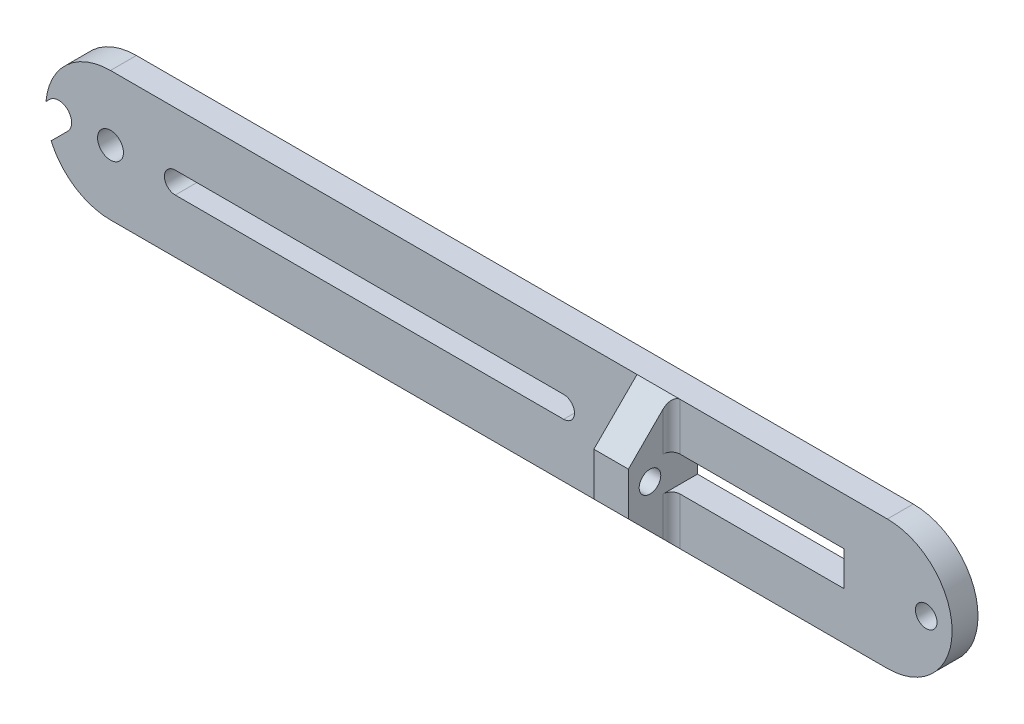
from build123d import *

# Parameters (mm, degrees)
ESQUISSE1_R             = 2.5
ESQUISSE1_R_2           = 3
ESQUISSE1_W             = 40
ESQUISSE1_H             = 8
BOSS_EXTRU_1_DEPTH      = 6
ESQUISSE2_R             = 2.5
BOSS_EXTRU_2_DEPTH      = 8
CONG_2_R                = 2
ENL_V_MAT_EXTRU_1_DEPTH = 4
ENL_V_START             = -10
ENL_V_MAT_EXTRU_4_DEPTH = 10


with BuildPart() as part:
    # Esquisse1 → Boss.-Extru.1 (new body)
    with BuildSketch(Plane.XY):
        with BuildLine():
            Line((90, -15), (-90, -15))
            ThreePointArc((-90, -15), (-105, 0), (-90, 15))
            Line((-90, 15), (90, 15))
            ThreePointArc((90, 15), (105, 0), (90, -15))
        make_face()
        with Locations((99, 0)):
            Circle(ESQUISSE1_R, mode=Mode.SUBTRACT)
        with Locations(Location((-90, 0, 0), (0, 0, 180))):
            Circle(ESQUISSE1_R_2, mode=Mode.SUBTRACT)
        with BuildLine():
            Line((15, -2.5), (-75, -2.5))
            ThreePointArc((-75, -2.5), (-77.5, 0), (-75, 2.5))
            Line((-75, 2.5), (15, 2.5))
            ThreePointArc((15, 2.5), (17.5, 0), (15, -2.5))
        make_face(mode=Mode.SUBTRACT)
        with Locations((60, 0)):
            Rectangle(ESQUISSE1_W, ESQUISSE1_H, mode=Mode.SUBTRACT)
    extrude(amount=BOSS_EXTRU_1_DEPTH)

    # Esquisse2 → Boss.-Extru.2 (add)
    with BuildSketch(Plane(origin=(40, 0, 0), x_dir=(0, 0, -1), z_dir=(1, 0, 0))):
        Polygon((-16, 5), (-16, -5), (-6, -15), (-6, -5), (-6, 5), (-6, 15), align=None)
        with Locations((-11, 0)):
            Circle(ESQUISSE2_R, mode=Mode.SUBTRACT)
    extrude(amount=-BOSS_EXTRU_2_DEPTH)

    # Congé2
    cong_2_edges = [part.edges().sort_by_distance(p)[0] for p in [
        (40, 9.5, 6),
        (40, -9.5, 6),
    ]]
    fillet(cong_2_edges, radius=CONG_2_R)

    # Esquisse3 → Enlèv. mat.-Extru.1 (cut)
    with BuildSketch(Plane.ZY.offset(-32)):
        Polygon((11, 4), (14.464101615, 2), (14.464101615, -2), (11, -4), (7.535898385, -2), (7.535898385, 2), align=None)
    extrude(amount=-ENL_V_MAT_EXTRU_1_DEPTH, mode=Mode.SUBTRACT)

    # Esquisse4 → Enlèv. mat.-Extru.4 (cut)
    with BuildSketch(Plane.XY.offset(6).offset(ENL_V_START)):
        with BuildLine():
            ThreePointArc((-105, -2.6e-08), (-103.148050285, -2.771638603), (-99.878679656, -2.121320344))
            Line((-99.878679656, -2.121320344), (-104.121320344, 2.121320344))
            ThreePointArc((-104.121320344, 2.121320344), (-104.771638603, 1.148050285), (-105, -2.6e-08))
        make_face()
        with BuildLine():
            Line((-104.121320344, 2.121320344), (-99.878679656, -2.121320344))
            ThreePointArc((-99.878679656, -2.121320344), (-99.228361402, -1.148050297), (-99, 0))
            ThreePointArc((-99, 0), (-100.851949703, 2.771638598), (-104.121320344, 2.121320344))
        make_face()
        with BuildLine():
            ThreePointArc((-105, -2.6e-08), (-104.771638603, 1.148050285), (-104.121320344, 2.121320344))
            Line((-104.121320344, 2.121320344), (-104.94364809, 1.298992597))
            ThreePointArc((-104.94364809, 1.298992597), (-104.985905401, 0.650107152), (-105, -2.6e-08))
        make_face()
        with BuildLine():
            Line((-103.750652313, -5.993293), (-99.878679656, -2.121320344))
            ThreePointArc((-99.878679656, -2.121320344), (-103.148050285, -2.771638603), (-105, -2.6e-08))
            ThreePointArc((-105, -2.6e-08), (-104.684341738, -3.061063171), (-103.750652313, -5.993293))
        make_face()
        with BuildLine():
            ThreePointArc((-105, -2.6e-08), (-103.148050285, -2.771638603), (-99.878679656, -2.121320344))
            Line((-99.878679656, -2.121320344), (-104.121320344, 2.121320344))
            ThreePointArc((-104.121320344, 2.121320344), (-104.771638603, 1.148050285), (-105, -2.6e-08))
        make_face()
        with BuildLine():
            Line((-104.121320344, 2.121320344), (-99.878679656, -2.121320344))
            ThreePointArc((-99.878679656, -2.121320344), (-99.228361402, -1.148050297), (-99, 0))
            ThreePointArc((-99, 0), (-100.851949703, 2.771638598), (-104.121320344, 2.121320344))
        make_face()
    extrude(amount=ENL_V_MAT_EXTRU_4_DEPTH, mode=Mode.SUBTRACT)


solid = part.part
